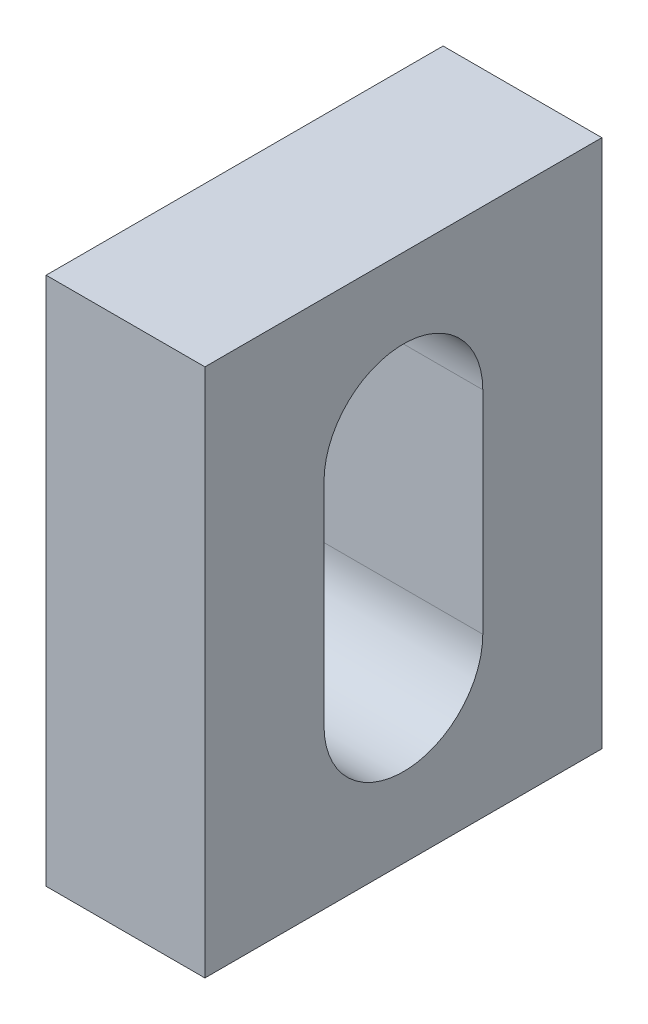
from build123d import *

# Parameters (mm, degrees)
SKETCH1_W           = 15
SKETCH1_H           = 20
BOSS_EXTRUDE1_DEPTH = 6


with BuildPart() as part:
    # Sketch1 → Boss-Extrude1 (new body)
    with BuildSketch(Plane(origin=(0, 0, 0), x_dir=(0, 0, -1), z_dir=(1, 0, 0))):
        with Locations((7.5, 10)):
            Rectangle(SKETCH1_W, SKETCH1_H)
        with BuildLine():
            Line((4.5, 6), (4.5, 14))
            ThreePointArc((4.5, 14), (7.5, 17), (10.5, 14))
            Line((10.5, 14), (10.5, 6))
            ThreePointArc((10.5, 6), (7.5, 3), (4.5, 6))
        make_face(mode=Mode.SUBTRACT)
    extrude(amount=BOSS_EXTRUDE1_DEPTH)


solid = part.part
